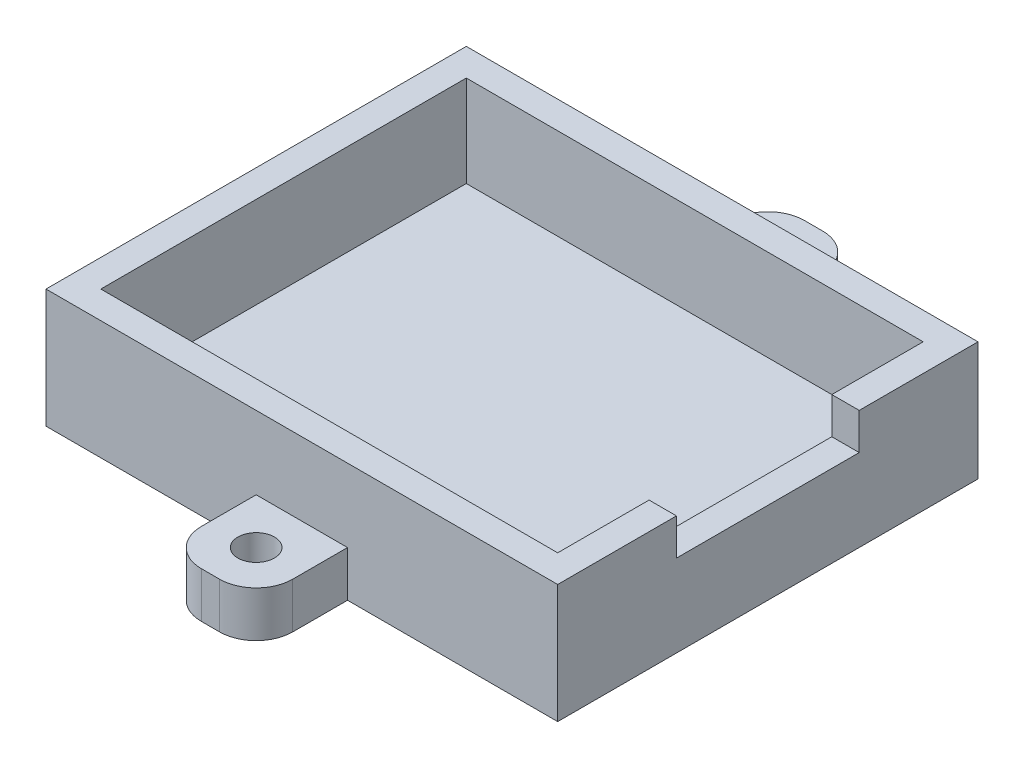
from build123d import *

# Parameters (mm, degrees)
SKETCH_1_W          = 28
SKETCH_1_H          = 23
EXTRUDE_1_DEPTH     = 1.5
SKETCH_2_W          = 28
SKETCH_2_H          = 23
SKETCH_2_W_2        = 25
SKETCH_2_H_2        = 20
EXTRUDE_2_DEPTH     = 5
SKETCH_4_W          = 10
SKETCH_4_H          = 2
CUT_EXTRUDE_1_DEPTH = 2
SKETCH_5_W          = 5
SKETCH_5_H          = 33
EXTRUDE_3_DEPTH     = 2.5
SKETCH_6_W          = 5
SKETCH_6_H          = 20
CUT_EXTRUDE_2_DEPTH = 1
SKETCH_7_R          = 1
CUT_EXTRUDE_3_DEPTH = 40.799497484
FILLET_1_R          = 2


with BuildPart() as part:
    # 草图1 → 凸台-拉伸1 (new body)
    with BuildSketch(Plane(origin=(0, 0, 0), x_dir=(1, 0, 0), z_dir=(0, 1, 0))):
        with Locations((14, -11.5)):
            Rectangle(SKETCH_1_W, SKETCH_1_H)
    extrude(amount=EXTRUDE_1_DEPTH)

    # 草图2 → 凸台-拉伸2 (add)
    with BuildSketch(Plane(origin=(0, 1.5, 0), x_dir=(1, 0, 0), z_dir=(0, 1, 0))):
        with Locations((14, -11.5)):
            Rectangle(SKETCH_2_W, SKETCH_2_H)
        with Locations((14, -11.5)):
            Rectangle(SKETCH_2_W_2, SKETCH_2_H_2, mode=Mode.SUBTRACT)
    extrude(amount=EXTRUDE_2_DEPTH)

    # 草图4 → 切除-拉伸1 (cut)
    with BuildSketch(Plane(origin=(28, 0, 0), x_dir=(0, 0, -1), z_dir=(1, 0, 0))):
        with Locations((-11.5, 5.5)):
            Rectangle(SKETCH_4_W, SKETCH_4_H)
    extrude(amount=-CUT_EXTRUDE_1_DEPTH, mode=Mode.SUBTRACT)

    # 草图5 → 凸台-拉伸3 (add)
    with BuildSketch(Plane.XZ):
        with Locations((14, 11.5)):
            Rectangle(SKETCH_5_W, SKETCH_5_H)
    extrude(amount=-EXTRUDE_3_DEPTH)

    # 草图6 → 切除-拉伸2 (cut)
    with BuildSketch(Plane(origin=(0, 2.5, 0), x_dir=(1, 0, 0), z_dir=(0, 1, 0))):
        with Locations((14, -11.5)):
            Rectangle(SKETCH_6_W, SKETCH_6_H)
    extrude(amount=-CUT_EXTRUDE_2_DEPTH, mode=Mode.SUBTRACT)

    # 草图7 → 切除-拉伸3 (cut, through all)
    with BuildSketch(Plane(origin=(0, 2.5, 0), x_dir=(1, 0, 0), z_dir=(0, 1, 0))):
        with Locations(Location((14, 2.5, 0), (0, 0, 270))):
            Circle(SKETCH_7_R)
        with Locations(Location((14, -25.5, 0), (0, 0, 270))):
            Circle(SKETCH_7_R)
    extrude(amount=-CUT_EXTRUDE_3_DEPTH, mode=Mode.SUBTRACT)

    # 圆角1
    fillet_1_edges = [part.edges().sort_by_distance(p)[0] for p in [
        (11.5, 1.25, -5),
        (16.5, 1.25, 28),
        (11.5, 1.25, 28),
        (16.5, 1.25, -5),
    ]]
    fillet(fillet_1_edges, radius=FILLET_1_R)


solid = part.part
